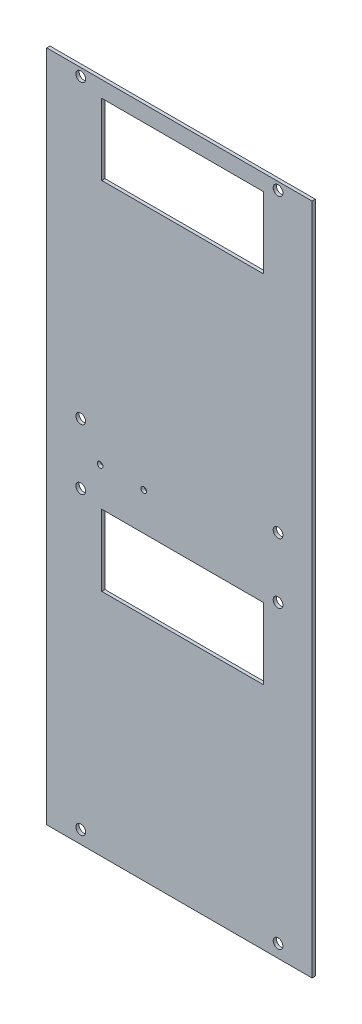
from build123d import *

# Parameters (mm, degrees)
SKETCH1_W                    = 82
SKETCH1_H                    = 208
BOSS_EXTRUDE1_DEPTH          = 1
F_3_0_3_DIAMETER_HOLE1_D     = 3
SKETCH7_W                    = 50
SKETCH7_H                    = 22
CUT_EXTRUDE1_DEPTH           = 10
F_1_75_1_75_DIAMETER_HOLE1_D = 1.75


with BuildPart() as part:
    # Sketch1 → Boss-Extrude1 (new body)
    with BuildSketch(Plane.XY):
        Rectangle(SKETCH1_W, SKETCH1_H)
    extrude(amount=BOSS_EXTRUDE1_DEPTH)

    # Ø3.0 (3) Diameter Hole1 (through all)
    with Locations(Plane.XY.offset(1)):
        with Locations((-30.5, 10), (30.5, 10), (30.5, -100), (-30.5, -100), (-30.5, 101.59999968), (30.5, 101.59999968), (30.5, -8.7), (-30.5, -8.7)):
            Hole(F_3_0_3_DIAMETER_HOLE1_D / 2)

    # Sketch7 → Cut-Extrude1 (cut)
    with BuildSketch(Plane(origin=(0, 0, 0), x_dir=(-1, 0, 0), z_dir=(0, 0, -1))):
        with Locations((-1, -22)):
            Rectangle(SKETCH7_W, SKETCH7_H)
        with Locations((-1, 88)):
            Rectangle(SKETCH7_W, SKETCH7_H)
    extrude(amount=-CUT_EXTRUDE1_DEPTH, mode=Mode.SUBTRACT)

    # Ø1.75 (1.75) Diameter Hole1 (through all)
    with Locations(Plane(origin=(0, 0, 0), x_dir=(-1, 0, 0), z_dir=(0, 0, -1))):
        with Locations((24.5, 0.65), (11, 0.65)):
            Hole(F_1_75_1_75_DIAMETER_HOLE1_D / 2)


solid = part.part
